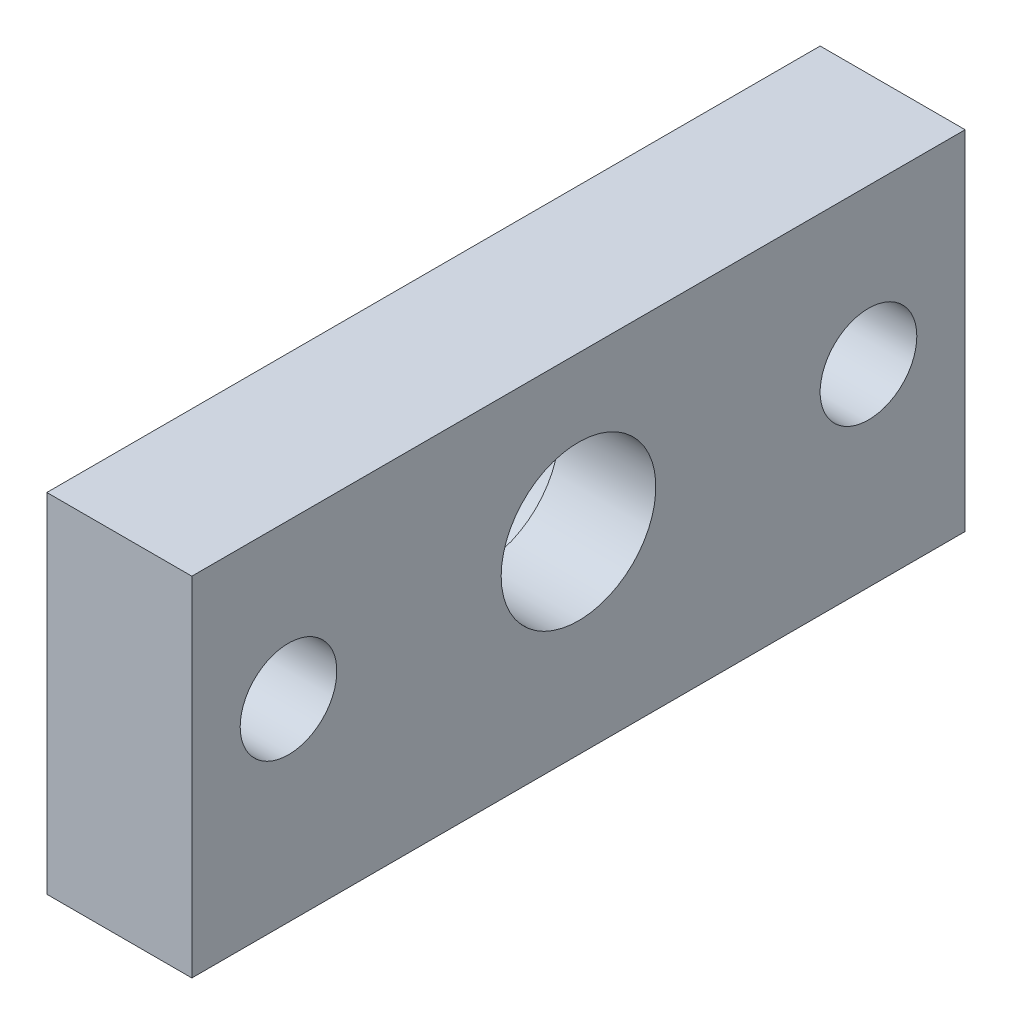
from build123d import *

# Parameters (mm, degrees)
SKETCH_1_W             = 80
SKETCH_1_H             = 36
EXTRUDE_1_DEPTH        = 15
HOLE_WIZARD_M6_1_D     = 5
HOLE_WIZARD_M6_1_DEPTH = 8
HOLE_WIZARD_M6_1_TIP   = 1.502151548
SKETCH_4_R             = 12
CUT_EXTRUDE_1_DEPTH    = 5
SKETCH_5_R             = 5
CUT_EXTRUDE_2_DEPTH    = 15
SKETCH_6_R             = 8
CUT_EXTRUDE_3_DEPTH    = 45.988887517


with BuildPart() as part:
    # 草图1 → 凸台-拉伸1 (new body)
    with BuildSketch(Plane(origin=(0, 0, 0), x_dir=(0, 0, -1), z_dir=(1, 0, 0))):
        Rectangle(SKETCH_1_W, SKETCH_1_H)
    extrude(amount=EXTRUDE_1_DEPTH)

    # M6 螺纹孔1
    with Locations(Plane.XZ.offset(18)):
        with Locations((7.5, 30), (7.5, 10), (7.5, -10), (7.5, -30)):
            Hole(HOLE_WIZARD_M6_1_D / 2, depth=HOLE_WIZARD_M6_1_DEPTH)
            with Locations((0, 0, -(HOLE_WIZARD_M6_1_DEPTH + HOLE_WIZARD_M6_1_TIP / 2))):  # 118° drill point
                Cone(0, HOLE_WIZARD_M6_1_D / 2, HOLE_WIZARD_M6_1_TIP, mode=Mode.SUBTRACT)

    # 草图4 → 切除-拉伸1 (cut)
    with BuildSketch(Plane.ZY):
        with Locations((0, 2)):
            Circle(SKETCH_4_R)
    extrude(amount=-CUT_EXTRUDE_1_DEPTH, mode=Mode.SUBTRACT)

    # 草图5 → 切除-拉伸2 (cut)
    with BuildSketch(Plane.ZY):
        with Locations((30, 2)):
            Circle(SKETCH_5_R)
    cut_extrude_2 = extrude(amount=-CUT_EXTRUDE_2_DEPTH, mode=Mode.SUBTRACT)

    # 镜向1: 切除-拉伸2 across plane
    add(cut_extrude_2.mirror(Plane.XY), mode=Mode.SUBTRACT)

    # 草图6 → 切除-拉伸3 (cut, through all)
    with BuildSketch(Plane.ZY.offset(-5)):
        with Locations((0, 2)):
            Circle(SKETCH_6_R)
    extrude(amount=-CUT_EXTRUDE_3_DEPTH, mode=Mode.SUBTRACT)


solid = part.part
